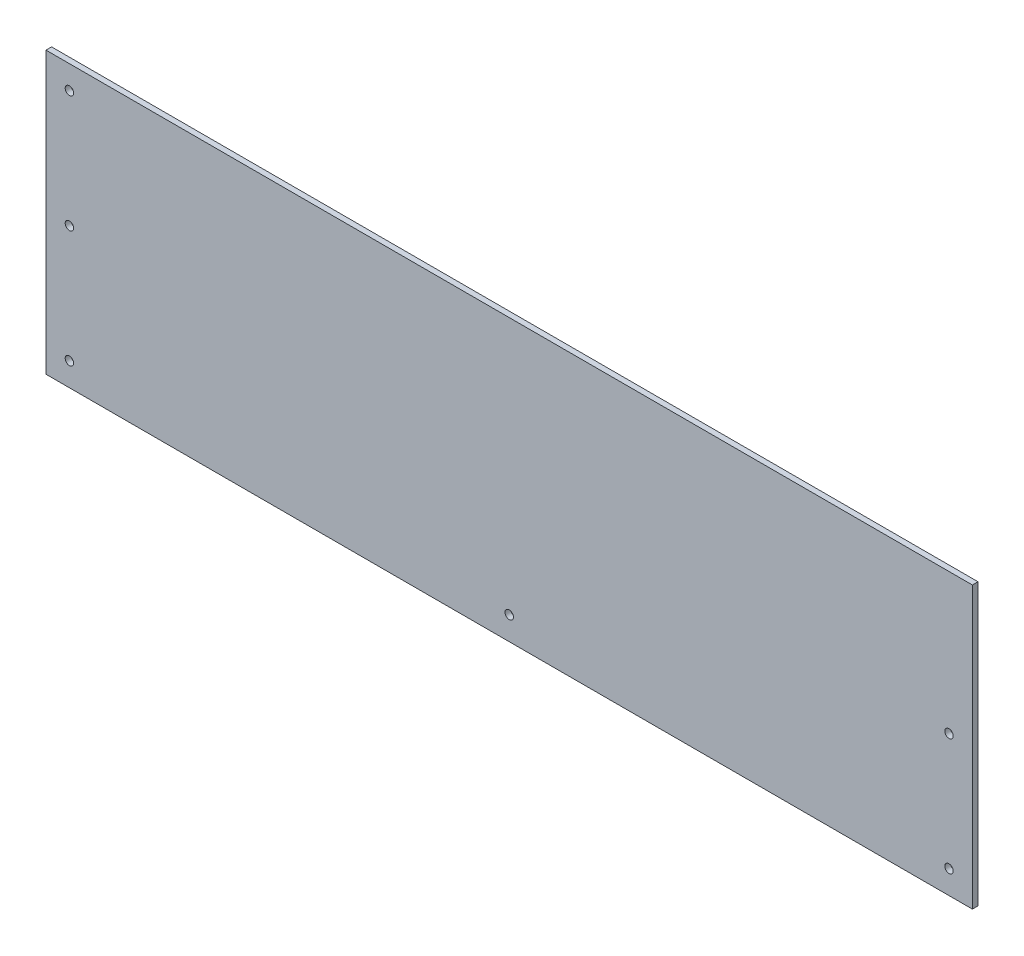
from build123d import *

# Parameters (mm, degrees)
SKETCH1_W            = 495
SKETCH1_H            = 150
BOSS_EXTRUDE1_DEPTH  = 3
M4_CLEARANCE_HOLE1_D = 4.5


with BuildPart() as part:
    # Sketch1 → Boss-Extrude1 (new body)
    with BuildSketch(Plane.XY):
        with Locations((247.5, 75)):
            Rectangle(SKETCH1_W, SKETCH1_H)
    extrude(amount=BOSS_EXTRUDE1_DEPTH)

    # M4 Clearance Hole1 (through all)
    with Locations(Plane.XY.offset(3)):
        with Locations((12.5, 75), (12.5, 137.5), (12.5, 12.5), (247.5, 12.5), (482.5, 12.5), (482.5, 75), (482.5, 237.5)):
            Hole(M4_CLEARANCE_HOLE1_D / 2)


solid = part.part
